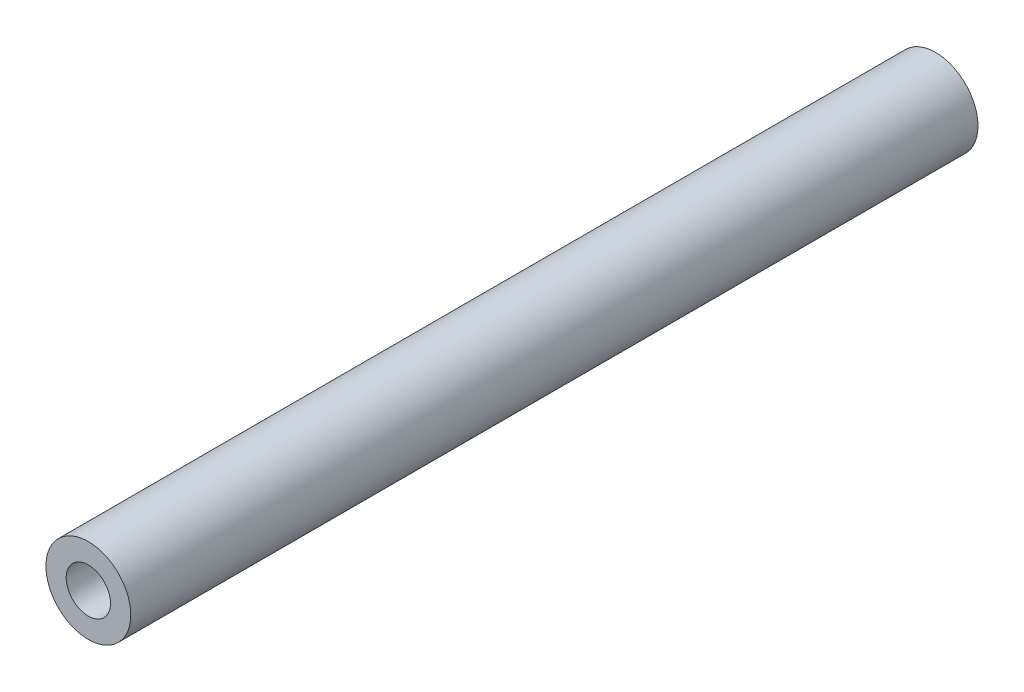
from build123d import *

# Parameters (mm, degrees)
SKETCH1_R           = 4.7625
SKETCH1_R_2         = 2.4892
BOSS_EXTRUDE1_DEPTH = 95.123


with BuildPart() as part:
    # Sketch1 → Boss-Extrude1 (new body)
    with BuildSketch(Plane.XY):
        Circle(SKETCH1_R)
        Circle(SKETCH1_R_2, mode=Mode.SUBTRACT)
    extrude(amount=-BOSS_EXTRUDE1_DEPTH)


solid = part.part
